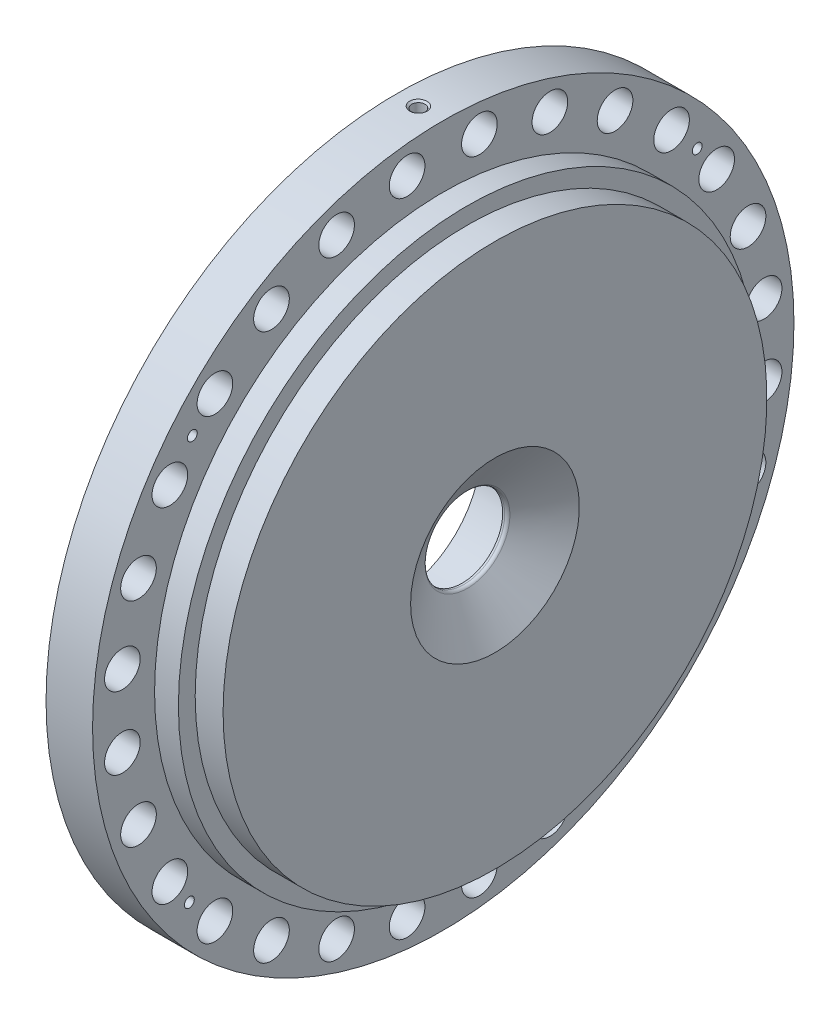
from build123d import *

# Parameters (mm, degrees)
SKETCH4_R                         = 14.2875
CUT_EXTRUDE1_DEPTH                = 406.190469782
CIRPATTERN2_COUNT                 = 28
CIRPATTERN3_COUNT                 = 12
CIRPATTERN4_COUNT                 = 4
CIRPATTERN5_COUNT                 = 56
F_1_2_13_TAPPED_HOLE4_D           = 10.71626
F_1_2_13_TAPPED_HOLE4_DEPTH       = 35.052
F_1_2_13_TAPPED_HOLE4_CSINK_D     = 13.97
F_1_2_13_TAPPED_HOLE4_CSINK_ANGLE = 100
F_1_2_13_TAPPED_HOLE4_TIP         = 3.219489309


with BuildPart() as part:
    # Sketch1 → Revolve1 (revolve)
    with BuildSketch(Plane.XY, mode=Mode.PRIVATE) as revolve1_sk:
        with BuildLine():
            Line((-4.7752, 67.5132), (-4.7752, 180.9496))
            Line((-4.7752, 180.9496), (0, 180.9496))
            Line((0, 180.9496), (0, 228.9937))
            Line((0, 228.9937), (-4.7752, 228.9937))
            Line((-4.7752, 228.9937), (-4.7752, 281.051))
            Line((-4.7752, 281.051), (32.512, 281.051))
            Line((32.512, 281.051), (32.512, 231.3686))
            Line((32.512, 231.3686), (51.6128, 231.3686))
            Line((51.6128, 231.3686), (51.6128, 217.9066))
            Line((51.6128, 217.9066), (73.9648, 217.9066))
            Line((73.9648, 217.9066), (73.9648, 67.6275))
            Line((73.9648, 67.6275), (51.892823931, 33.9957528))
            ThreePointArc((51.892823931, 33.9957528), (50.746661337, 32.943911593), (49.238413158, 32.5628))
            Line((49.238413158, 32.5628), (47.625, 32.5628))
            Line((47.625, 32.5628), (47.625, 67.5132))
            Line((47.625, 67.5132), (-4.7752, 67.5132))
        make_face()
    revolve(revolve1_sk.sketch.rotate(Axis((0, 0, 0), (1, 0, 0)), 90), axis=Axis((0, 0, 0), (1, 0, 0)))

    # Sketch4 → Cut-Extrude1 (cut, through all)
    with BuildSketch(Plane.ZY.offset(4.7752)):
        with Locations((28.972111579, 257.135466548)):
            Circle(SKETCH4_R)
    cut_extrude1 = extrude(amount=-CUT_EXTRUDE1_DEPTH, mode=Mode.SUBTRACT)

    # CirPattern2: Cut-Extrude1 ×28 about axis
    cirpattern2_axis = Axis((0, 0, 0), (1, 0, 0))
    for i in range(1, CIRPATTERN2_COUNT):
        add(cut_extrude1.rotate(cirpattern2_axis, i * 360 / CIRPATTERN2_COUNT), mode=Mode.SUBTRACT)

    # Sketch8 → 3/4-10 Tapped Hole1 (revolve, cut)
    with BuildSketch(Plane(origin=(0, 199.3429424, 53.413780433), x_dir=(0, 0, 1), z_dir=(0, 1, 0))):
        Polygon((0, 0), (0, 30.407416175), (8.33374, 25.4), (8.33374, 1.82626), (10.16, 0), align=None)
    f_3_4_10_tapped_hole1 = revolve(axis=Axis((-6.35, 199.3429424, 53.413780433), (1, 0, 0)), mode=Mode.SUBTRACT)

    # CirPattern3: 3/4-10 Tapped Hole1 ×12 about axis
    cirpattern3_axis = Axis((0, 0, 0), (1, 0, 0))
    for i in range(1, CIRPATTERN3_COUNT):
        add(f_3_4_10_tapped_hole1.rotate(cirpattern3_axis, i * 360 / CIRPATTERN3_COUNT), mode=Mode.SUBTRACT)

    # Sketch10 → 7/8-9 Tapped Hole1 (revolve, cut)
    with BuildSketch(Plane(origin=(-4.7752, 67.172315786, 67.172315786), x_dir=(0, 0, 1), z_dir=(0, 1, 0))):
        Polygon((0, 0), (0, 31.242239902), (9.72312, 25.4), (9.72312, 2.02438), (11.7475, 0), align=None)
    f_7_8_9_tapped_hole1 = revolve(axis=Axis((-11.1252, 67.172315786, 67.172315786), (1, 0, 0)), mode=Mode.SUBTRACT)

    # CirPattern4: 7/8-9 Tapped Hole1 ×4 about axis
    cirpattern4_axis = Axis((0, 0, 0), (1, 0, 0))
    for i in range(1, CIRPATTERN4_COUNT):
        add(f_7_8_9_tapped_hole1.rotate(cirpattern4_axis, i * 360 / CIRPATTERN4_COUNT), mode=Mode.SUBTRACT)

    # Sketch21 → Tap Drill for 3/8-16 Tap1 (revolve, cut)
    with BuildSketch(Plane(origin=(-4.7752, 162.844517689, 201.096231852), x_dir=(0, 0, 1), z_dir=(0, 1, 0))):
        Polygon((0, 0), (0, 43.024665582), (3.96875, 40.64), (3.96875, 0.635), (4.60375, 0), align=None)
    tap_drill_for_3_8_16_tap1 = revolve(axis=Axis((-11.1252, 162.844517689, 201.096231852), (1, 0, 0)), mode=Mode.SUBTRACT)

    # CirPattern5: Tap Drill for 3/8-16 Tap1 ×56 about axis, 52 skipped
    cirpattern5_axis = Axis((0, 0, 0), (-1, 0, 0))
    add([tap_drill_for_3_8_16_tap1.rotate(cirpattern5_axis, i * 360 / CIRPATTERN5_COUNT) for i in range(1, CIRPATTERN5_COUNT) if i not in (1, 2, 3, 4, 5, 6, 7, 8, 9, 10, 11, 12, 13, 14, 15, 17, 18, 19, 20, 21, 22, 23, 24, 25, 26, 27, 29, 30, 31, 32, 33, 34, 35, 36, 37, 38, 39, 40, 41, 42, 43, 45, 46, 47, 48, 49, 50, 51, 52, 53, 54, 55)], mode=Mode.SUBTRACT)

    # 1/2-13 Tapped Hole4
    with Locations(Plane(origin=(12.5984, 281.051, 0), x_dir=(0, 0, 1), z_dir=(0, 1, 0))):
        with Locations((0, 0)):
            CounterSinkHole(F_1_2_13_TAPPED_HOLE4_D / 2, F_1_2_13_TAPPED_HOLE4_CSINK_D / 2, depth=F_1_2_13_TAPPED_HOLE4_DEPTH, counter_sink_angle=F_1_2_13_TAPPED_HOLE4_CSINK_ANGLE)
            with Locations((0, 0, -(F_1_2_13_TAPPED_HOLE4_DEPTH + F_1_2_13_TAPPED_HOLE4_TIP / 2))):  # 118° drill point
                Cone(0, F_1_2_13_TAPPED_HOLE4_D / 2, F_1_2_13_TAPPED_HOLE4_TIP, mode=Mode.SUBTRACT)


solid = part.part
